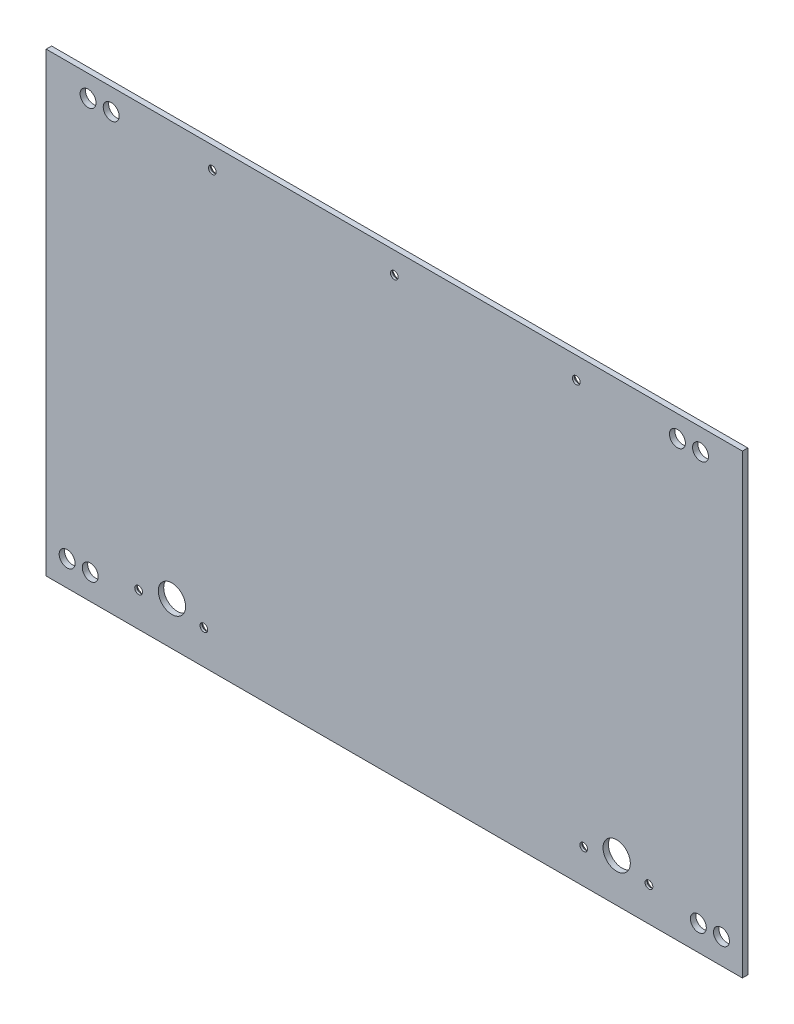
from build123d import *

# Parameters (mm, degrees)
SKETCH1_W                                      = 306.05
SKETCH1_H                                      = 197.425
SKETCH1_R                                      = 10.775
BOSS_EXTRUDE1_DEPTH                            = 2.38125
SKETCH9_W                                      = 306.05
SKETCH9_H                                      = 2.38125
BOSS_EXTRUDE2_DEPTH                            = 3.175
SKETCH10_R                                     = 3.5
CUT_EXTRUDE1_DEPTH                             = 184.856965146
CSK_FOR_M3_FLAT_HEAD_MACHINE_SCREW1_AT_2_COUNT = 2
CSK_FOR_M3_FLAT_HEAD_MACHINE_SCREW1_AT_2_PITCH = 28.69
CSK_FOR_M3_FLAT_HEAD_MACHINE_SCREW1_AT_3_COUNT = 2
CSK_FOR_M3_FLAT_HEAD_MACHINE_SCREW1_AT_3_PITCH = 178.948509983
CSK_FOR_M3_FLAT_HEAD_MACHINE_SCREW1_AT_4_COUNT = 2
CSK_FOR_M3_FLAT_HEAD_MACHINE_SCREW1_AT_4_PITCH = 208.645558843
CSK_FOR_M3_FLAT_HEAD_MACHINE_SCREW1_AT_5_COUNT = 2
CSK_FOR_M3_FLAT_HEAD_MACHINE_SCREW1_AT_5_PITCH = 260.467597265
CSK_FOR_M3_FLAT_HEAD_MACHINE_SCREW1_AT_6_COUNT = 2
CSK_FOR_M3_FLAT_HEAD_MACHINE_SCREW1_AT_6_PITCH = 224.342
CSK_FOR_M3_FLAT_HEAD_MACHINE_SCREW1_AT_7_COUNT = 2
CSK_FOR_M3_FLAT_HEAD_MACHINE_SCREW1_AT_7_PITCH = 195.652
SKETCH13_R                                     = 6
CUT_EXTRUDE2_DEPTH                             = 184.856965146


with BuildPart() as part:
    # Sketch1 → Boss-Extrude1 (new body)
    # profile 1 of 5: a face of its own
    with BuildSketch(Plane.XY):
        Rectangle(SKETCH1_W, SKETCH1_H)
        with Locations((-142.25, -87.9375)):
            Circle(SKETCH1_R, mode=Mode.SUBTRACT)
        with Locations((-130.25, -64.9375)):
            Circle(SKETCH1_R, mode=Mode.SUBTRACT)
    # profile 2 of 5: a face of its own
    with BuildSketch(Plane.XY):
        with Locations((-130.25, -64.9375)):
            Circle(SKETCH1_R)
    # profile 3 of 5: a face of its own
    with BuildSketch(Plane.XY):
        with Locations((-142.25, -87.9375)):
            Circle(SKETCH1_R)
    # profile 4 of 5: a face of its own
    with BuildSketch(Plane.XY):
        with BuildLine():
            ThreePointArc((-142.25, -98.7125), (-149.869075567, -95.556575567), (-153.025, -87.9375))
            Line((-153.025, -87.9375), (-153.025, -98.7125))
            Line((-153.025, -98.7125), (-142.25, -98.7125))
        make_face()
    # profile 5 of 5: a face of its own
    with BuildSketch(Plane.XY):
        Rectangle(SKETCH1_W, SKETCH1_H)
    extrude(amount=BOSS_EXTRUDE1_DEPTH)

    # Sketch9 → Boss-Extrude2 (add)
    with BuildSketch(Plane(origin=(0, 98.7125, 0), x_dir=(1, 0, 0), z_dir=(0, 1, 0))):
        with Locations((0, -1.190625)):
            Rectangle(SKETCH9_W, SKETCH9_H)
    extrude(amount=BOSS_EXTRUDE2_DEPTH)

    # Sketch10 → Cut-Extrude1 (cut, through all)
    with BuildSketch(Plane(origin=(0, 0, 0), x_dir=(-1, 0, 0), z_dir=(0, 0, -1))):
        with Locations((-134.610000066, 92.3625)):
            Circle(SKETCH10_R)
        with Locations((-124.450000066, 92.3625)):
            Circle(SKETCH10_R)
        with Locations((-143.817500066, -87.5375001)):
            Circle(SKETCH10_R)
        with Locations((-133.657500066, -87.5375001)):
            Circle(SKETCH10_R)
    cut_extrude1 = extrude(amount=-CUT_EXTRUDE1_DEPTH, mode=Mode.SUBTRACT)

    # Mirror1: Cut-Extrude1 across plane
    add(cut_extrude1.mirror(Plane(origin=(0, 0, 0), x_dir=(0, 0, 1), z_dir=(1, 0, 0))), mode=Mode.SUBTRACT)

    # Sketch12 → CSK for M3 Flat Head Machine Screw1 (revolve, cut)
    with BuildSketch(Plane(origin=(111.94, -83.7125, 0), x_dir=(0, 1, 0), z_dir=(1, 0, 0))):
        Polygon((0, 0), (0, 2.38125), (1.7, 2.38125), (1.7, 1.45), (3.15, 0), align=None)
    csk_for_m3_flat_head_machine_screw1 = revolve(axis=Axis((111.94, -83.7125, -6.35), (0, 0, 1)), mode=Mode.SUBTRACT)

    # CSK for M3 Flat Head Machine Screw1 at 2: CSK for M3 Flat Head Machine Screw1 ×2
    with Locations(*[(-i * CSK_FOR_M3_FLAT_HEAD_MACHINE_SCREW1_AT_2_PITCH, 0, 0) for i in range(1, CSK_FOR_M3_FLAT_HEAD_MACHINE_SCREW1_AT_2_COUNT)]):
        add(csk_for_m3_flat_head_machine_screw1, mode=Mode.SUBTRACT)

    # CSK for M3 Flat Head Machine Screw1 at 3: CSK for M3 Flat Head Machine Screw1 ×2
    with Locations(*[Vector(-0.17848709666869053, 0.9839422525345589, 0) * (i * CSK_FOR_M3_FLAT_HEAD_MACHINE_SCREW1_AT_3_PITCH) for i in range(1, CSK_FOR_M3_FLAT_HEAD_MACHINE_SCREW1_AT_3_COUNT)]):
        add(csk_for_m3_flat_head_machine_screw1, mode=Mode.SUBTRACT)

    # CSK for M3 Flat Head Machine Screw1 at 4: CSK for M3 Flat Head Machine Screw1 ×2
    with Locations(*[Vector(-0.5365079449598512, 0.8438952689729675, 0) * (i * CSK_FOR_M3_FLAT_HEAD_MACHINE_SCREW1_AT_4_PITCH) for i in range(1, CSK_FOR_M3_FLAT_HEAD_MACHINE_SCREW1_AT_4_COUNT)]):
        add(csk_for_m3_flat_head_machine_screw1, mode=Mode.SUBTRACT)

    # CSK for M3 Flat Head Machine Screw1 at 5: CSK for M3 Flat Head Machine Screw1 ×2
    with Locations(*[Vector(-0.7369054808176358, 0.6759957931384847, 0) * (i * CSK_FOR_M3_FLAT_HEAD_MACHINE_SCREW1_AT_5_PITCH) for i in range(1, CSK_FOR_M3_FLAT_HEAD_MACHINE_SCREW1_AT_5_COUNT)]):
        add(csk_for_m3_flat_head_machine_screw1, mode=Mode.SUBTRACT)

    # CSK for M3 Flat Head Machine Screw1 at 6: CSK for M3 Flat Head Machine Screw1 ×2
    with Locations(*[(-i * CSK_FOR_M3_FLAT_HEAD_MACHINE_SCREW1_AT_6_PITCH, 0, 0) for i in range(1, CSK_FOR_M3_FLAT_HEAD_MACHINE_SCREW1_AT_6_COUNT)]):
        add(csk_for_m3_flat_head_machine_screw1, mode=Mode.SUBTRACT)

    # CSK for M3 Flat Head Machine Screw1 at 7: CSK for M3 Flat Head Machine Screw1 ×2
    with Locations(*[(-i * CSK_FOR_M3_FLAT_HEAD_MACHINE_SCREW1_AT_7_PITCH, 0, 0) for i in range(1, CSK_FOR_M3_FLAT_HEAD_MACHINE_SCREW1_AT_7_COUNT)]):
        add(csk_for_m3_flat_head_machine_screw1, mode=Mode.SUBTRACT)

    # Sketch13 → Cut-Extrude2 (cut, through all)
    with BuildSketch(Plane(origin=(0, 0, 0), x_dir=(-1, 0, 0), z_dir=(0, 0, -1))):
        with Locations((-97.75, -79.7125001)):
            Circle(SKETCH13_R)
        with Locations((97.75, -79.7125001)):
            Circle(SKETCH13_R)
    extrude(amount=-CUT_EXTRUDE2_DEPTH, mode=Mode.SUBTRACT)


solid = part.part
